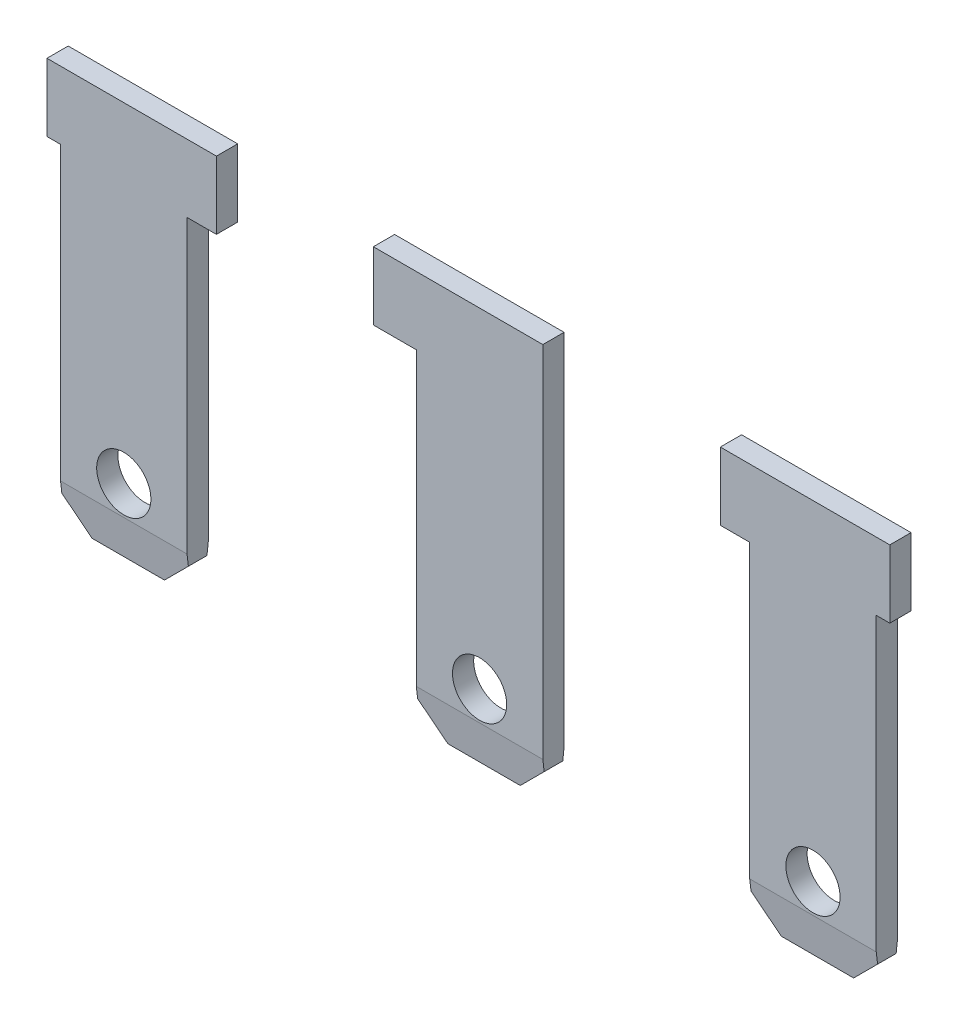
from build123d import *

# Parameters (mm, degrees)
SKETCH1_R               = 0.6
BOSS_EXTRUDE1_DEPTH     = 0.47
BOSS_EXTRUDE1_2_DEPTH   = 0.47
BOSS_EXTRUDE1_3_DEPTH   = 0.47
CUT_EXTRUDE1_DEPTH      = 17.696707276
CUT_EXTRUDE1_DEPTH_BACK = 17.696707276


with BuildPart() as part:
    # Sketch1 → Boss-Extrude1 (new body)
    with BuildSketch(Plane.XY):
        Polygon((-7.457142857, -3.580592992), (-3.707142857, -3.580592992), (-3.707142857, -5.080592992), (-4.357142857, -5.080592992), (-4.357142857, -11.780592992), (-4.957142857, -12.380592992), (-6.557142857, -12.380592992), (-7.157142857, -11.780592992), (-7.157142857, -5.080592992), (-7.457142857, -5.080592992), align=None)
        with Locations((-5.757142857, -10.880592992)):
            Circle(SKETCH1_R, mode=Mode.SUBTRACT)
    extrude(amount=BOSS_EXTRUDE1_DEPTH)


with BuildPart() as body_2:
    # Sketch1 → Boss-Extrude1 2 (new body)
    with BuildSketch(Plane.XY):
        Polygon((-0.234501348, -3.580592992), (3.515498652, -3.580592992), (3.515498652, -5.080592992), (3.515498652, -11.780592992), (2.915498652, -12.380592992), (1.315498652, -12.380592992), (0.715498652, -11.780592992), (0.715498652, -5.080592992), (-0.234501348, -5.080592992), align=None)
        with Locations((2.115498652, -10.880592992)):
            Circle(SKETCH1_R, mode=Mode.SUBTRACT)
    extrude(amount=BOSS_EXTRUDE1_2_DEPTH)


with BuildPart() as body_3:
    # Sketch1 → Boss-Extrude1 3 (new body)
    with BuildSketch(Plane.XY):
        Polygon((11.192857143, -3.580592992), (7.442857143, -3.580592992), (7.442857143, -5.080592992), (8.092857143, -5.080592992), (8.092857143, -11.780592992), (8.692857143, -12.380592992), (10.292857143, -12.380592992), (10.892857143, -11.780592992), (10.892857143, -5.080592992), (11.192857143, -5.080592992), align=None)
        with Locations((9.492857143, -10.880592992)):
            Circle(SKETCH1_R, mode=Mode.SUBTRACT)
    extrude(amount=BOSS_EXTRUDE1_3_DEPTH)


with BuildPart() as cut_extrude1_tool:
    # Sketch2 → Cut-Extrude1 (new, two sides: drawn at the far end of the back side and taken through both)
    with BuildSketch(Plane(origin=(0, 0, 0), x_dir=(0, 0, -1), z_dir=(1, 0, 0)).offset(-CUT_EXTRUDE1_DEPTH_BACK)):
        Polygon((-0.47, -11.530592992), (-0.37, -12.380592992), (-0.47, -12.380592992), align=None)
        Polygon((-0.1, -12.380592992), (0, -12.380592992), (0, -11.530592992), align=None)
    extrude(amount=CUT_EXTRUDE1_DEPTH + CUT_EXTRUDE1_DEPTH_BACK)


with BuildPart() as part_1:
    add(part.part)

    # Cut-Extrude1: cut by cut_extrude1_tool
    add(cut_extrude1_tool.part, mode=Mode.SUBTRACT)


with BuildPart() as body_2_1:
    add(body_2.part)

    # Cut-Extrude1: cut by cut_extrude1_tool
    add(cut_extrude1_tool.part, mode=Mode.SUBTRACT)


with BuildPart() as body_3_1:
    add(body_3.part)

    # Cut-Extrude1: cut by cut_extrude1_tool
    add(cut_extrude1_tool.part, mode=Mode.SUBTRACT)


solid = Compound([part_1.part, body_2_1.part, body_3_1.part])
